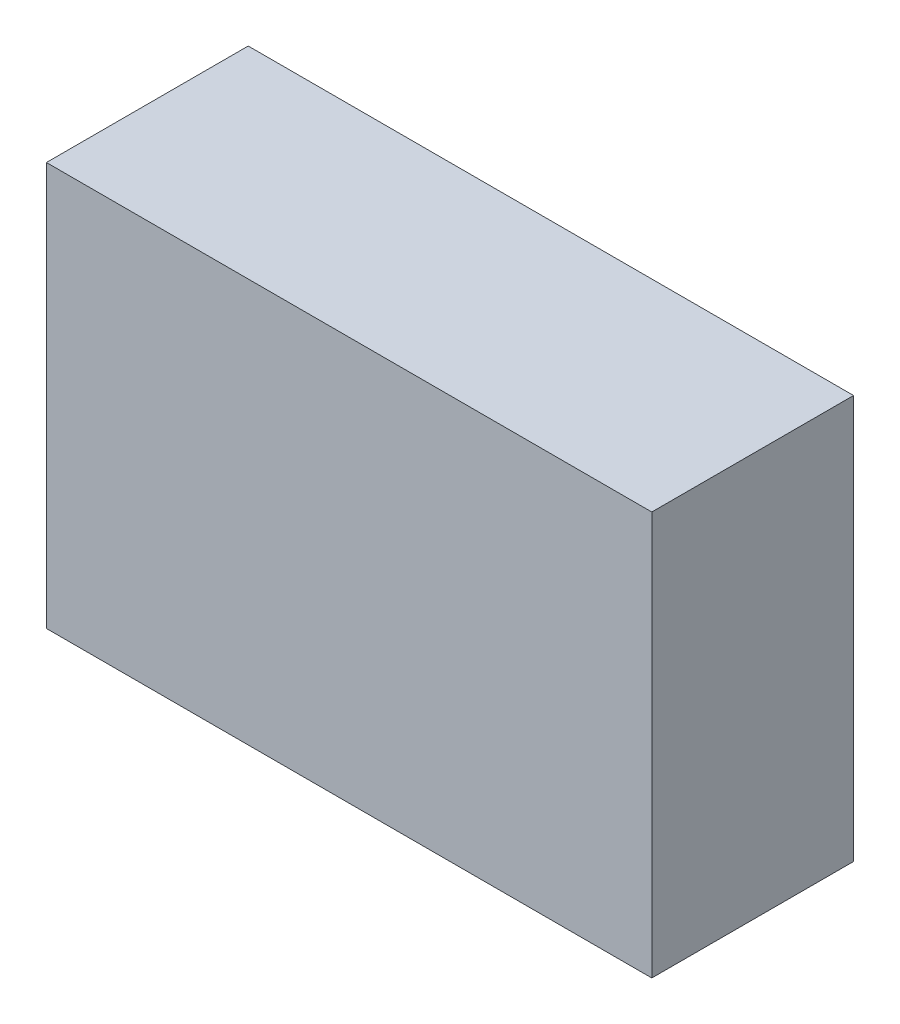
from build123d import *

# Parameters (mm, degrees)
SKETCH1_W           = 152.4
SKETCH1_H           = 50.8
BOSS_EXTRUDE1_DEPTH = 101.6


with BuildPart() as part:
    # Sketch1 → Boss-Extrude1 (new body)
    with BuildSketch(Plane(origin=(0, 0, 0), x_dir=(1, 0, 0), z_dir=(0, 1, 0))):
        with Locations((76.2, 25.4)):
            Rectangle(SKETCH1_W, SKETCH1_H)
    extrude(amount=BOSS_EXTRUDE1_DEPTH)


solid = part.part
